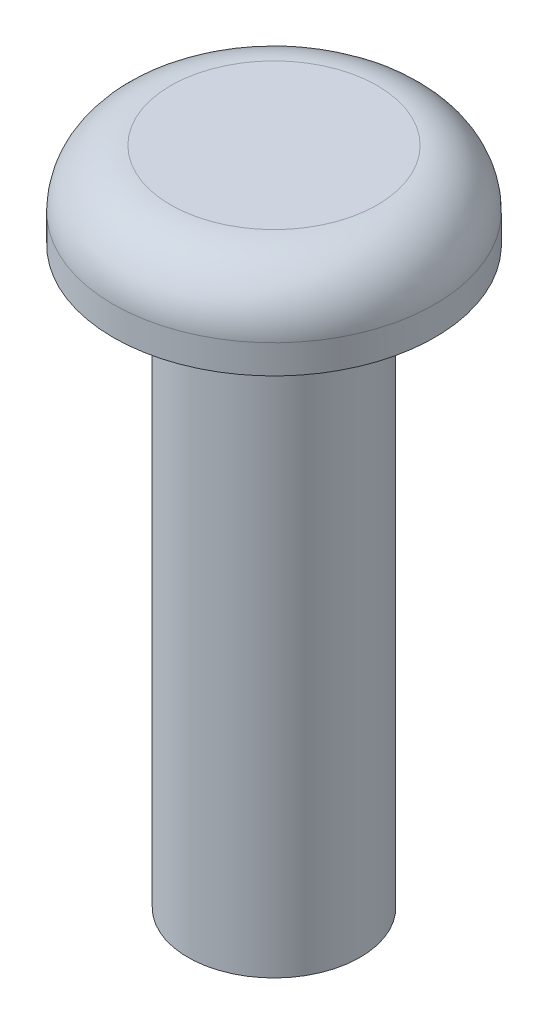
from build123d import *

# Parameters (mm, degrees)
SKETCH1_R           = 2.8
BOSS_EXTRUDE1_DEPTH = 1.5
FILLET1_R           = 1
SKETCH2_R           = 1.5
BOSS_EXTRUDE2_DEPTH = 10


with BuildPart() as part:
    # Sketch1 → Boss-Extrude1 (new body)
    with BuildSketch(Plane(origin=(0, 0, 0), x_dir=(1, 0, 0), z_dir=(0, 1, 0))):
        with Locations(Location((0, 0, 0), (0, 0, 270))):
            Circle(SKETCH1_R)
    extrude(amount=BOSS_EXTRUDE1_DEPTH)

    # Fillet1
    fillet1_edges = [part.edges().sort_by_distance(p)[0] for p in [
        (0, 1.5, -2.8),
    ]]
    fillet(fillet1_edges, radius=FILLET1_R)

    # Sketch2 → Boss-Extrude2 (add)
    with BuildSketch(Plane.XZ):
        with Locations(Location((0, 0, 0), (0, 0, 270))):
            Circle(SKETCH2_R)
    extrude(amount=BOSS_EXTRUDE2_DEPTH)


solid = part.part
